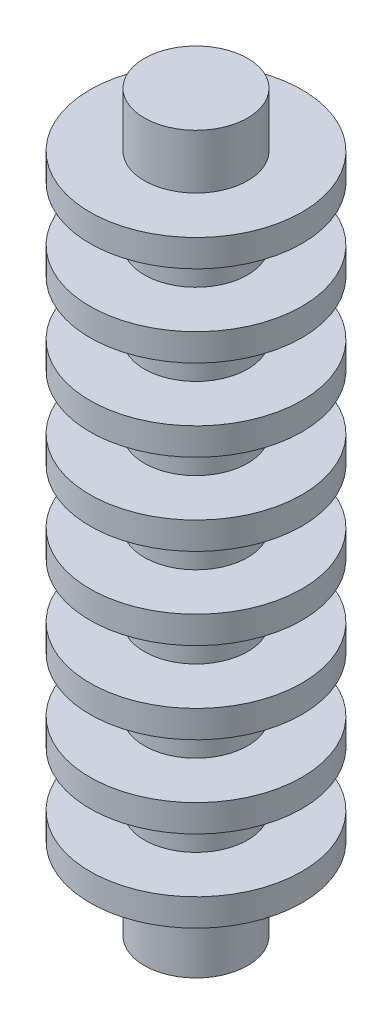
from build123d import *


with BuildPart() as part:
    # Sketch1 → Revolve1 (revolve)
    with BuildSketch(Plane.XY, mode=Mode.PRIVATE) as revolve1_sk:
        Polygon((3.8, 24), (3.8, 23), (7.8, 23), (7.8, 21), (3.8, 21), (3.8, 18), (3.8, 17), (7.8, 17), (7.8, 15), (3.8, 15), (3.8, 12), (3.8, 11), (7.8, 11), (7.8, 9), (3.8, 9), (3.8, 6), (3.8, 5), (7.8, 5), (7.8, 3), (3.8, 3), (3.8, 0), (3.8, -1), (7.8, -1), (7.8, -3), (3.8, -3), (3.8, -6), (3.8, -7), (7.8, -7), (7.8, -9), (3.8, -9), (3.8, -12), (3.8, -13), (7.8, -13), (7.8, -15), (3.8, -15), (3.8, -18), (3.8, -19), (7.8, -19), (7.8, -21), (3.8, -21), (3.8, -24), (3.8, -27), (0, -27), (0, 27), (3.8, 27), align=None)
    revolve(revolve1_sk.sketch.rotate(Axis((0, 27, 0), (0, -1, 0)), 180), axis=Axis((0, 27, 0), (0, -1, 0)))


solid = part.part
